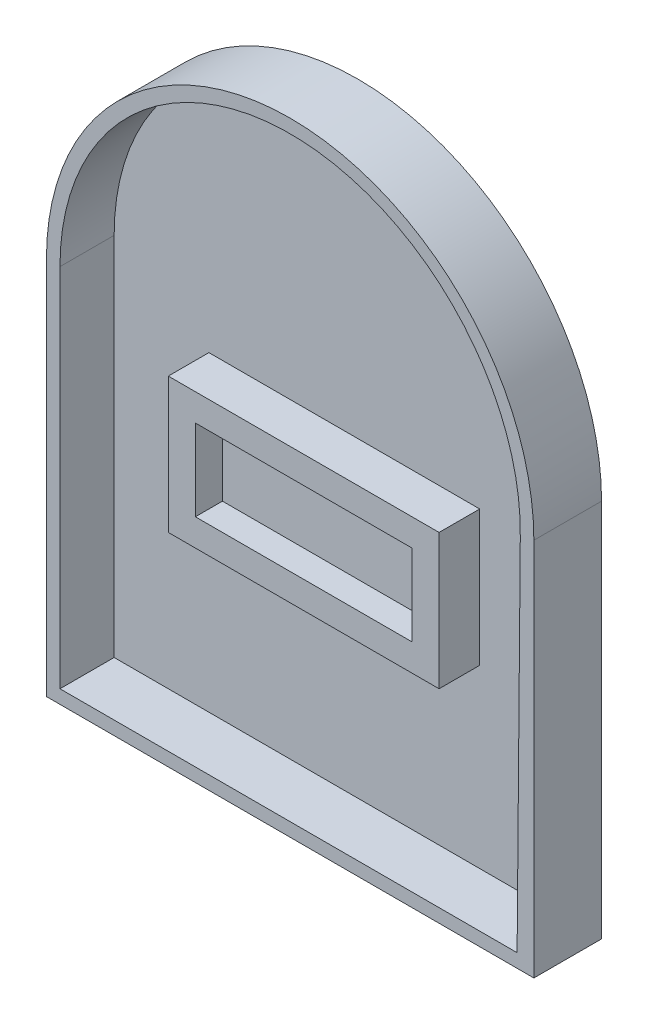
from build123d import *

# Parameters (mm, degrees)
BOSS_EXTRUDE1_DEPTH = 20
BOSS_EXTRUDE2_START = 5
BOSS_EXTRUDE2_DEPTH = 5
SKETCH3_W           = 100
SKETCH3_H           = 50
BOSS_EXTRUDE3_DEPTH = 15
SHELL1_T            = -10


with BuildPart() as part:
    # Sketch1 → Boss-Extrude1 (new body)
    with BuildSketch(Plane.XY):
        with BuildLine():
            Line((-90, 0), (-90, -140))
            Line((-90, -140), (90, -140))
            Line((90, -140), (90, 0))
            ThreePointArc((90, 0), (0, 90), (-90, 0))
        make_face()
        with BuildLine():
            Line((-85, 0), (-85, -135))
            Line((-85, -135), (83.811538659, -135))
            Line((83.811538659, -135), (84.986825994, -1.496464972))
            ThreePointArc((84.986825994, -1.496464972), (0.74826148, 84.996706435), (-85, 0))
        make_face(mode=Mode.SUBTRACT)
    extrude(amount=BOSS_EXTRUDE1_DEPTH)

    # Sketch2 → Boss-Extrude2 (add)
    with BuildSketch(Plane(origin=(0, 0, 0), x_dir=(-1, 0, 0), z_dir=(0, 0, -1)).offset(BOSS_EXTRUDE2_START)):
        with BuildLine():
            Line((-90, 0), (-90, -140))
            Line((-90, -140), (90, -140))
            Line((90, -140), (90, 0))
            ThreePointArc((90, 0), (0, 90), (-90, 0))
        make_face()
    extrude(amount=-BOSS_EXTRUDE2_DEPTH)

    # Sketch3 → Boss-Extrude3 (add)
    with BuildSketch(Plane.XY):
        with Locations((0, -45)):
            Rectangle(SKETCH3_W, SKETCH3_H)
    extrude(amount=BOSS_EXTRUDE3_DEPTH)

    # Shell1
    shell1_openings = [part.faces().sort_by_distance(p)[0] for p in [
        (0, -45, 15),
    ]]
    offset(amount=SHELL1_T, openings=shell1_openings)


solid = part.part
